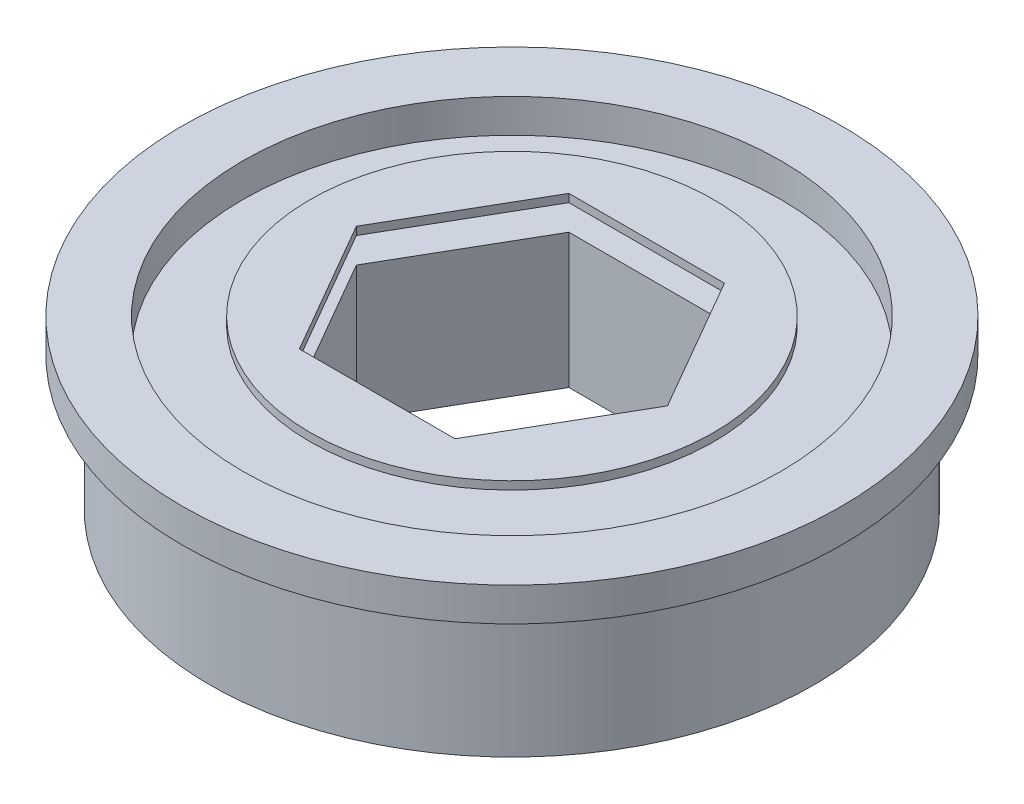
from build123d import *

# Parameters (mm, degrees)
SKETCH1_W             = 15.5575
SKETCH1_H             = 1.5875
M22_CLEARANCE_HOLE1_D = 25.4
SKETCH4_R             = 9.525
BOSS_EXTRUDE1_DEPTH   = 0.381
SKETCH5_R             = 14.2748
BOSS_EXTRUDE2_DEPTH   = 6.35
CUT_EXTRUDE1_DEPTH    = 24.389645546


with BuildPart() as part:
    # Sketch1 → Revolve1 (revolve)
    with BuildSketch(Plane(origin=(0, 0, 0), x_dir=(-1, 0, 0), z_dir=(0, 0, -1)), mode=Mode.PRIVATE) as revolve1_sk:
        with Locations((-7.77875, 7.14375)):
            Rectangle(SKETCH1_W, SKETCH1_H)
    revolve(revolve1_sk.sketch.rotate(Axis((0, 6.35, 0), (0, 1, 0)), 270), axis=Axis((0, 6.35, 0), (0, 1, 0)))

    # M22 Clearance Hole1 (through all)
    with Locations(Plane(origin=(0, 7.9375, 0), x_dir=(1, 0, 0), z_dir=(0, 1, 0))):
        with Locations((0, 0)):
            Hole(M22_CLEARANCE_HOLE1_D / 2)

    # Sketch5 → Boss-Extrude2 (add)
    with BuildSketch(Plane.XZ.offset(-6.35)):
        with Locations(Location((0, 0, 0), (0, 0, 270))):
            Circle(SKETCH5_R)
    extrude(amount=BOSS_EXTRUDE2_DEPTH)


with BuildPart() as body_2:
    # Sketch4 → Boss-Extrude1 (new body)
    with BuildSketch(Plane.XZ.offset(-7.5565)):
        with Locations(Location((0, 0, 0), (0, 0, 90))):
            Circle(SKETCH4_R)
    extrude(amount=-BOSS_EXTRUDE1_DEPTH)


with BuildPart() as cut_extrude1_tool:
    # Sketch6 → Cut-Extrude1 (new, through all)
    with BuildSketch(Plane.XZ):
        Polygon((-3.671947712, 6.36), (-7.343895424, 0), (-3.671947712, -6.36), (3.671947712, -6.36), (7.343895424, 0), (3.671947712, 6.36), align=None)
    extrude(amount=-CUT_EXTRUDE1_DEPTH)


with BuildPart() as part_1:
    add(part.part)

    # Cut-Extrude1: cut by cut_extrude1_tool
    add(cut_extrude1_tool.part, mode=Mode.SUBTRACT)


with BuildPart() as body_2_1:
    add(body_2.part)

    # Cut-Extrude1: cut by cut_extrude1_tool
    add(cut_extrude1_tool.part, mode=Mode.SUBTRACT)


solid = Compound([part_1.part, body_2_1.part])
